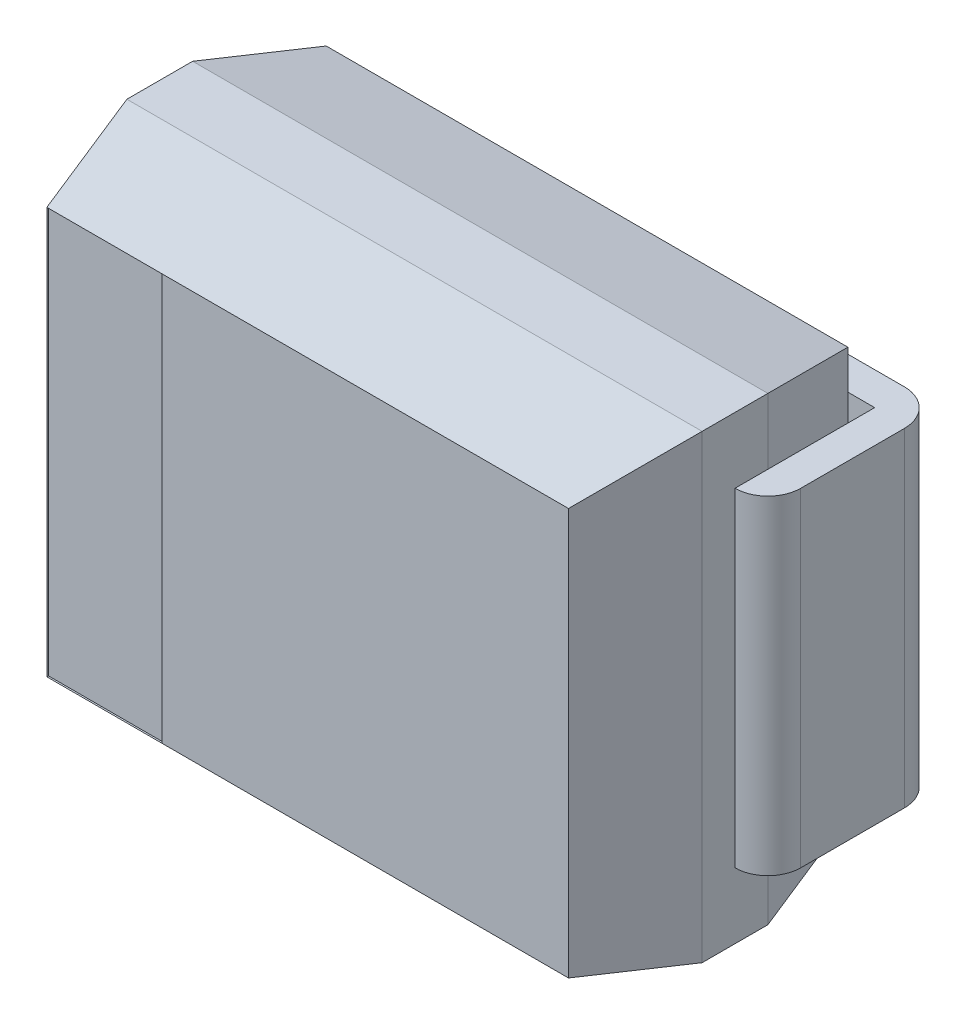
from build123d import *
from OCP.BRepFilletAPI import BRepFilletAPI_MakeChamfer

# Parameters (mm, degrees)
SKETCH_1_W           = 3.5
SKETCH_1_H           = 2.8
EXTRUDE_1_DEPTH      = 1.7
CHAMFER_1_SIZE       = 0.65
CHAMFER_1_SIZE2      = 0.163
CHAMFER_2_SIZE       = 0.163
CHAMFER_2_SIZE2      = 0.65
EXTRUDE_2_DEPTH      = 1
EXTRUDE_2_DEPTH_BACK = 1
SKETCH_3_W           = 0.7
SKETCH_3_H           = 2.474
CUT_EXTRUDE_1_DEPTH  = 0.01


with BuildPart() as part:
    # Эскиз1 → Бобышка-Вытянуть1 (new body)
    with BuildSketch(Plane.XY.offset(0.2)):
        Rectangle(SKETCH_1_W, SKETCH_1_H)
    extrude(amount=EXTRUDE_1_DEPTH)

    # Фаска1: one chamfer whose edges measure the first distance from different faces: ONE call of the kernel's chamfer builder (chamfer() names one face for all edges)
    chamfer_1_edges_1 = [part.edges().sort_by_distance(p)[0] for p in [
        (-1.75, 0, 1.9),
    ]]
    chamfer_1_side_1 = [part.faces().sort_by_distance(p)[0] for p in [
        (-1.75, 0, 1.05),
    ]]
    chamfer_1_edges_2 = [part.edges().sort_by_distance(p)[0] for p in [
        (0, -1.4, 1.9),
    ]]
    chamfer_1_side_2 = [part.faces().sort_by_distance(p)[0] for p in [
        (0, -1.4, 1.05),
    ]]
    chamfer_1_edges_3 = [part.edges().sort_by_distance(p)[0] for p in [
        (1.75, 0, 1.9),
    ]]
    chamfer_1_side_3 = [part.faces().sort_by_distance(p)[0] for p in [
        (1.75, 0, 1.05),
    ]]
    chamfer_1_edges_4 = [part.edges().sort_by_distance(p)[0] for p in [
        (0, 1.4, 1.9),
    ]]
    chamfer_1_side_4 = [part.faces().sort_by_distance(p)[0] for p in [
        (0, 1.4, 1.05),
    ]]
    chamfer_1 = BRepFilletAPI_MakeChamfer(part.part.solid().wrapped)
    for e in chamfer_1_edges_1:
        chamfer_1.Add(CHAMFER_1_SIZE, CHAMFER_1_SIZE2, e.wrapped, chamfer_1_side_1[0].wrapped)  # the first distance lies on this face
    for e in chamfer_1_edges_2:
        chamfer_1.Add(CHAMFER_1_SIZE, CHAMFER_1_SIZE2, e.wrapped, chamfer_1_side_2[0].wrapped)  # the first distance lies on this face
    for e in chamfer_1_edges_3:
        chamfer_1.Add(CHAMFER_1_SIZE, CHAMFER_1_SIZE2, e.wrapped, chamfer_1_side_3[0].wrapped)  # the first distance lies on this face
    for e in chamfer_1_edges_4:
        chamfer_1.Add(CHAMFER_1_SIZE, CHAMFER_1_SIZE2, e.wrapped, chamfer_1_side_4[0].wrapped)  # the first distance lies on this face
    add(Compound.cast(chamfer_1.Shape()), mode=Mode.REPLACE)

    # Фаска2
    chamfer_2_edges = [part.edges().sort_by_distance(p)[0] for p in [
        (0, -1.4, 0.2),
        (-1.75, 0, 0.2),
        (0, 1.4, 0.2),
        (1.75, 0, 0.2),
    ]]
    chamfer_2_side = [part.faces().sort_by_distance(p)[0] for p in [
        (0, 0, 0.2),
    ]]
    chamfer(chamfer_2_edges, length=CHAMFER_2_SIZE, length2=CHAMFER_2_SIZE2, reference=chamfer_2_side[0])

    # Эскиз3 → Вырез-Вытянуть1 (cut)
    with BuildSketch(Plane.XY.offset(1.9)):
        with Locations((-1.237, 0)):
            Rectangle(SKETCH_3_W, SKETCH_3_H)
    extrude(amount=-CUT_EXTRUDE_1_DEPTH, mode=Mode.SUBTRACT)


with BuildPart() as body_2:
    # Эскиз2 → Бобышка-Вытянуть2 (new, two sides: drawn at the far end of the back side and taken through both)
    with BuildSketch(Plane(origin=(0, 0, 0), x_dir=(1, 0, 0), z_dir=(0, 1, 0)).offset(-EXTRUDE_2_DEPTH_BACK)):
        with BuildLine():
            Line((-1.75, -0.2), (-1.75, -0.85))
            Line((-1.75, -0.85), (-1.75, -1.05))
            ThreePointArc((-1.75, -1.05), (-1.891421356, -0.991421356), (-1.95, -0.85))
            Line((-1.95, -0.85), (-1.95, -0.22))
            ThreePointArc((-1.95, -0.22), (-1.885563492, -0.064436508), (-1.73, 0))
            Line((-1.73, 0), (-0.815, 0))
            Line((-0.815, 0), (-0.815, -0.2))
            Line((-0.815, -0.2), (-1.75, -0.2))
        make_face()
    extrude(amount=EXTRUDE_2_DEPTH + EXTRUDE_2_DEPTH_BACK)


with BuildPart() as body_3:
    # Зеркальное отражение1: mirrored copy
    add(body_2.part.mirror(Plane(origin=(0, 0, 0), x_dir=(0, 0, 1), z_dir=(1, 0, 0))))


solid = Compound([part.part, body_2.part, body_3.part])
